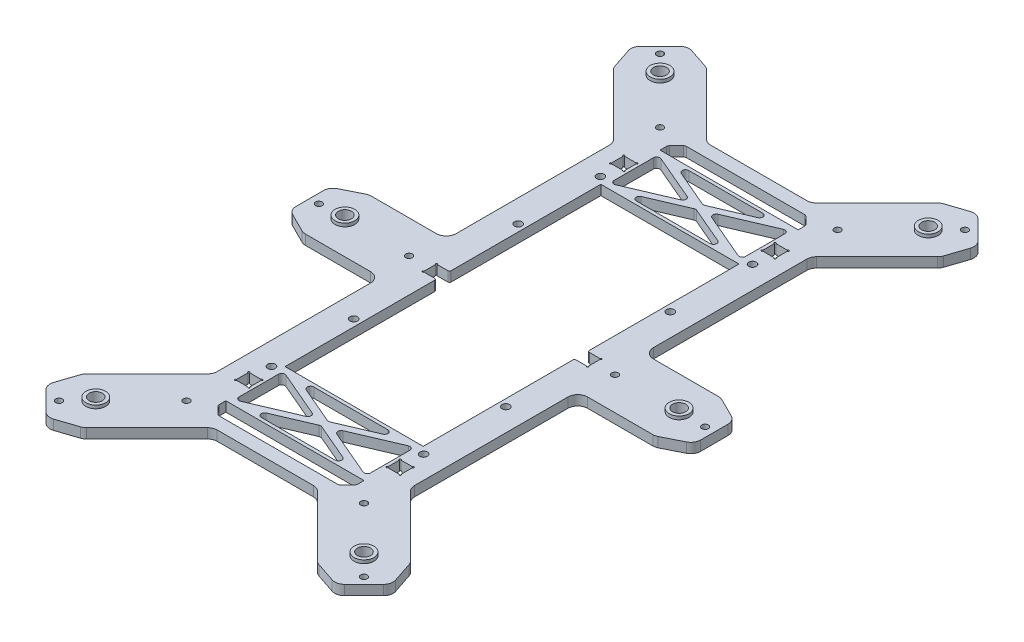
from build123d import *

# Parameters (mm, degrees)
EXTRUDE_1_DEPTH          = 1.5
SKETCH_2_R               = 1
EXTRUDE_2_DEPTH          = 3
MIRROR_2_COPY_1_SKETCH_R = 1
MIRROR_2_COPY_1_DEPTH    = 3
SKETCH_3_W               = 4
SKETCH_3_H               = 4
CUT_EXTRUDE_1_DEPTH      = 3
SKETCH_4_R               = 0.25
CUT_EXTRUDE_2_DEPTH      = 3
FILLET_1_R               = 0.5
FILLET_2_R               = 1
FILLET_3_R               = 3
FILLET_4_R               = 3
SKETCH_5_R               = 2
CUT_EXTRUDE_3_DEPTH      = 3
SKETCH_7_R               = 1.15
CUT_EXTRUDE_5_DEPTH      = 118.428811116
CUT_EXTRUDE_6_REACH      = 119.429
FILLET_5_R               = 3
SKETCH_9_W               = 42
SKETCH_9_H               = 18
EXTRUDE_3_DEPTH          = 3
CUT_EXTRUDE_7_DEPTH      = 3
FILLET_6_R               = 1
SKETCH_11_R              = 0.25
CUT_EXTRUDE_8_DEPTH      = 3
SKETCH_12_R              = 3
SKETCH_12_R_2            = 2
EXTRUDE_4_DEPTH          = 1


with BuildPart() as part:
    # 草图1 → 凸台-拉伸1 (new, symmetric)
    with BuildSketch(Plane(origin=(0, 0, 0), x_dir=(1, 0, 0), z_dir=(0, 1, 0))):
        Polygon((-20, 75), (-30, 65), (-30, -65), (-20, -75), (20, -75), (30, -65), (30, 65), (20, 75), align=None)
        Polygon((-18.343145751, 71), (-1.677763133, 71), (1.677763133, 71), (18.343145751, 71), (21, 68.343145751), (21, -68.343145751), (18.343145751, -71), (1.677763133, -71), (-1.677763133, -71), (-18.343145751, -71), (-21, -68.343145751), (-21, 68.343145751), align=None, mode=Mode.SUBTRACT)
    extrude(amount=EXTRUDE_1_DEPTH, both=True)

    # 草图2 → 凸台-拉伸2 (add, through all)
    # profile 1 of 2: a face of its own
    with BuildSketch(Plane(origin=(0, 1.5, 0), x_dir=(1, 0, 0), z_dir=(0, 1, 0))):
        with BuildLine():
            Line((28.5, 10), (60.5, 10))
            ThreePointArc((60.5, 10), (61.207106781, 9.707106781), (61.5, 9))
            Line((61.5, 9), (61.5, -9))
            ThreePointArc((61.5, -9), (61.207106781, -9.707106781), (60.5, -10))
            Line((60.5, -10), (28.5, -10))
            Line((28.5, -10), (28.5, 10))
        make_face()
        with Locations(Location((58.7, 0, 0), (0, 0, 270))):
            Circle(SKETCH_2_R, mode=Mode.SUBTRACT)
        with Locations(Location((31.3, 0, 0), (0, 0, 90))):
            Circle(SKETCH_2_R, mode=Mode.SUBTRACT)
    # profile 2 of 2: a face of its own
    with BuildSketch(Plane(origin=(0, 1.5, 0), x_dir=(1, 0, 0), z_dir=(0, 1, 0))):
        with BuildLine():
            Line((54.69848481, 85.556349186), (30, 60.857864376))
            Line((30, 60.857864376), (30, 65))
            Line((30, 65), (20, 75))
            Line((20, 75), (15.857864376, 75))
            Line((15.857864376, 75), (40.556349186, 99.69848481))
            ThreePointArc((40.556349186, 99.69848481), (41.263455967, 99.991378029), (41.970562748, 99.69848481))
            Line((41.970562748, 99.69848481), (54.69848481, 86.970562748))
            ThreePointArc((54.69848481, 86.970562748), (54.991378029, 86.263455967), (54.69848481, 85.556349186))
        make_face()
        with Locations(Location((46.354624792, 91.354624792, 0), (0, 0, 270))):
            Circle(SKETCH_2_R, mode=Mode.SUBTRACT)
        with Locations(Location((26.979898987, 71.979898987, 0), (0, 0, 90))):
            Circle(SKETCH_2_R, mode=Mode.SUBTRACT)
    extrude_2 = extrude(amount=-EXTRUDE_2_DEPTH)

    # 镜向1: 凸台-拉伸2 across plane
    add(extrude_2.mirror(Plane.XY))

    # 镜向2: 凸台-拉伸2 across plane
    add(extrude_2.mirror(Plane(origin=(0, 0, 0), x_dir=(0, 0, 1), z_dir=(1, 0, 0))))

    # 镜向2 copy 1 sketch → 镜向2 copy 1 (add, through all)
    # profile 1 of 2: a face of its own
    with BuildSketch(Plane(origin=(0, 1.5, 0), x_dir=(-1, 0, 0), z_dir=(0, 1, 0))):
        with BuildLine():
            Line((28.5, 10), (60.5, 10))
            ThreePointArc((60.5, 10), (61.207106781, 9.707106781), (61.5, 9))
            Line((61.5, 9), (61.5, -9))
            ThreePointArc((61.5, -9), (61.207106781, -9.707106781), (60.5, -10))
            Line((60.5, -10), (28.5, -10))
            Line((28.5, -10), (28.5, 10))
        make_face()
        with Locations(Location((58.7, 0, 0), (0, 0, 270))):
            Circle(MIRROR_2_COPY_1_SKETCH_R, mode=Mode.SUBTRACT)
        with Locations(Location((31.3, 0, 0), (0, 0, 90))):
            Circle(MIRROR_2_COPY_1_SKETCH_R, mode=Mode.SUBTRACT)
    # profile 2 of 2: a face of its own
    with BuildSketch(Plane(origin=(0, 1.5, 0), x_dir=(-1, 0, 0), z_dir=(0, 1, 0))):
        with BuildLine():
            Line((54.69848481, 85.556349186), (30, 60.857864376))
            Line((30, 60.857864376), (30, 65))
            Line((30, 65), (20, 75))
            Line((20, 75), (15.857864376, 75))
            Line((15.857864376, 75), (40.556349186, 99.69848481))
            ThreePointArc((40.556349186, 99.69848481), (41.263455967, 99.991378029), (41.970562748, 99.69848481))
            Line((41.970562748, 99.69848481), (54.69848481, 86.970562748))
            ThreePointArc((54.69848481, 86.970562748), (54.991378029, 86.263455967), (54.69848481, 85.556349186))
        make_face()
        with Locations(Location((46.354624792, 91.354624792, 0), (0, 0, 270))):
            Circle(MIRROR_2_COPY_1_SKETCH_R, mode=Mode.SUBTRACT)
        with Locations(Location((26.979898987, 71.979898987, 0), (0, 0, 90))):
            Circle(MIRROR_2_COPY_1_SKETCH_R, mode=Mode.SUBTRACT)
    extrude(amount=-MIRROR_2_COPY_1_DEPTH)

    # 草图3 → 切除-拉伸1 (cut)
    with BuildSketch(Plane(origin=(0, 1.5, 0), x_dir=(1, 0, 0), z_dir=(0, 1, 0))):
        with Locations((23, 0)):
            Rectangle(SKETCH_3_W, SKETCH_3_H)
        with Locations((23, -57)):
            Rectangle(SKETCH_3_W, SKETCH_3_H)
        with Locations((23, 57)):
            Rectangle(SKETCH_3_W, SKETCH_3_H)
        with Locations((-23, 57)):
            Rectangle(SKETCH_3_W, SKETCH_3_H)
        with Locations((-23, 0)):
            Rectangle(SKETCH_3_W, SKETCH_3_H)
        with Locations((-23, -57)):
            Rectangle(SKETCH_3_W, SKETCH_3_H)
    extrude(amount=-CUT_EXTRUDE_1_DEPTH, mode=Mode.SUBTRACT)

    # 草图4 → 切除-拉伸2 (cut)
    with BuildSketch(Plane(origin=(0, 1.5, 0), x_dir=(1, 0, 0), z_dir=(0, 1, 0))):
        with Locations((25, 59)):
            Circle(SKETCH_4_R)
        with Locations((25, 55)):
            Circle(SKETCH_4_R)
        with Locations((25, 2)):
            Circle(SKETCH_4_R)
        with Locations((25, -2)):
            Circle(SKETCH_4_R)
        with Locations((25, -55)):
            Circle(SKETCH_4_R)
        with Locations((25, -59)):
            Circle(SKETCH_4_R)
        with Locations((-25, -59)):
            Circle(SKETCH_4_R)
        with Locations((-25, -55)):
            Circle(SKETCH_4_R)
        with Locations((-25, -2)):
            Circle(SKETCH_4_R)
        with Locations((-25, 2)):
            Circle(SKETCH_4_R)
        with Locations((-25, 55)):
            Circle(SKETCH_4_R)
        with Locations((-25, 59)):
            Circle(SKETCH_4_R)
    extrude(amount=-CUT_EXTRUDE_2_DEPTH, mode=Mode.SUBTRACT)

    # 圆角1
    fillet_1_edges = [part.edges().sort_by_distance(p)[0] for p in [
        (-21, 0, -2),
        (-21, 0, 2),
        (21, 0, 2),
        (21, 0, -2),
    ]]
    fillet(fillet_1_edges, radius=FILLET_1_R)

    # 圆角2
    fillet_2_edges = [part.edges().sort_by_distance(p)[0] for p in [
        (-18.343145751, 0, -71),
        (-21, 0, -68.343145751),
        (-21, 0, 68.343145751),
        (-18.343145751, 0, 71),
        (18.343145751, 0, 71),
        (21, 0, 68.343145751),
        (21, 0, -68.343145751),
        (18.343145751, 0, -71),
    ]]
    fillet(fillet_2_edges, radius=FILLET_2_R)

    # 圆角3
    fillet_3_edges = [part.edges().sort_by_distance(p)[0] for p in [
        (15.857864376, 0, 75),
        (30, 0, 60.857864376),
        (-30, 0, 10),
        (-15.857864376, 0, 75),
        (-30, 0, 60.857864376),
        (30, 0, 10),
    ]]
    fillet(fillet_3_edges, radius=FILLET_3_R)

    # 圆角4
    fillet_4_edges = [part.edges().sort_by_distance(p)[0] for p in [
        (15.857864376, 0, -75),
        (30, 0, -60.857864376),
        (-30, 0, -10),
        (-15.857864376, 0, -75),
        (-30, 0, -60.857864376),
        (30, 0, -10),
    ]]
    fillet(fillet_4_edges, radius=FILLET_4_R)

    # 草图5 → 切除-拉伸3 (cut)
    with BuildSketch(Plane.XZ.offset(1.5)):
        with Locations(Location((-50.8, 0, 0), (0, 0, 270))):
            Circle(SKETCH_5_R)
        with Locations(Location((-40.76848122, -85.76848122, 0), (0, 0, 270))):
            Circle(SKETCH_5_R)
        with Locations(Location((-40.76848122, 85.76848122, 0), (0, 0, 90))):
            Circle(SKETCH_5_R)
        with Locations(Location((40.76848122, -85.76848122, 0), (0, 0, 90))):
            Circle(SKETCH_5_R)
        with Locations(Location((50.8, 0, 0), (0, 0, 90))):
            Circle(SKETCH_5_R)
        with Locations(Location((40.76848122, 85.76848122, 0), (0, 0, 270))):
            Circle(SKETCH_5_R)
    extrude(amount=-CUT_EXTRUDE_3_DEPTH, mode=Mode.SUBTRACT)

    # 草图7 → 切除-拉伸5 (cut, through all)
    with BuildSketch(Plane.XZ.offset(1.5)):
        with Locations(Location((-23.125, -25, 0), (0, 0, 270))):
            Circle(SKETCH_7_R)
        with Locations(Location((-23.125, -50, 0), (0, 0, 270))):
            Circle(SKETCH_7_R)
        with Locations(Location((-23.125, 50, 0), (0, 0, 90))):
            Circle(SKETCH_7_R)
        with Locations(Location((-23.125, 25, 0), (0, 0, 90))):
            Circle(SKETCH_7_R)
        with Locations(Location((23.125, -25, 0), (0, 0, 90))):
            Circle(SKETCH_7_R)
        with Locations(Location((23.125, -50, 0), (0, 0, 90))):
            Circle(SKETCH_7_R)
        with Locations(Location((23.125, 25, 0), (0, 0, 270))):
            Circle(SKETCH_7_R)
        with Locations(Location((23.125, 50, 0), (0, 0, 270))):
            Circle(SKETCH_7_R)
    extrude(amount=-CUT_EXTRUDE_5_DEPTH, mode=Mode.SUBTRACT)

    # 草图8 → 切除-拉伸6 (cut, up to next)
    with BuildSketch(Plane(origin=(0, 1.5, 0), x_dir=(1, 0, 0), z_dir=(0, 1, 0)), mode=Mode.PRIVATE) as cut_extrude_6_sk1:
        with BuildLine():
            Line((61.5, 6), (53.5, 10))
            Line((53.5, 10), (60.5, 10))
            ThreePointArc((60.5, 10), (61.207106781, 9.707106781), (61.5, 9))
            Line((61.5, 9), (61.5, 6))
        make_face()
    cut_extrude_6_tool1 = extrude(cut_extrude_6_sk1.sketch, amount=-CUT_EXTRUDE_6_REACH, mode=Mode.PRIVATE) & part.part
    # 草图8 → 切除-拉伸6 (cut, up to next)
    with BuildSketch(Plane(origin=(0, 1.5, 0), x_dir=(1, 0, 0), z_dir=(0, 1, 0)), mode=Mode.PRIVATE) as cut_extrude_6_sk2:
        with BuildLine():
            Line((61.5, -6), (53.5, -10))
            Line((53.5, -10), (60.5, -10))
            ThreePointArc((60.5, -10), (61.207106781, -9.707106781), (61.5, -9))
            Line((61.5, -9), (61.5, -6))
        make_face()
    cut_extrude_6_tool2 = extrude(cut_extrude_6_sk2.sketch, amount=-CUT_EXTRUDE_6_REACH, mode=Mode.PRIVATE) & part.part
    # 草图8 → 切除-拉伸6 (cut, up to next)
    with BuildSketch(Plane(origin=(0, 1.5, 0), x_dir=(1, 0, 0), z_dir=(0, 1, 0)), mode=Mode.PRIVATE) as cut_extrude_6_sk3:
        with BuildLine():
            Line((52.577164466, -89.091883092), (49.748737342, -80.606601718))
            Line((49.748737342, -80.606601718), (54.69848481, -85.556349186))
            ThreePointArc((54.69848481, -85.556349186), (54.991378029, -86.263455967), (54.69848481, -86.970562748))
            Line((54.69848481, -86.970562748), (52.577164466, -89.091883092))
        make_face()
    cut_extrude_6_tool3 = extrude(cut_extrude_6_sk3.sketch, amount=-CUT_EXTRUDE_6_REACH, mode=Mode.PRIVATE) & part.part
    # 草图8 → 切除-拉伸6 (cut, up to next)
    with BuildSketch(Plane(origin=(0, 1.5, 0), x_dir=(1, 0, 0), z_dir=(0, 1, 0)), mode=Mode.PRIVATE) as cut_extrude_6_sk4:
        with BuildLine():
            Line((44.091883092, -97.577164466), (35.606601718, -94.748737342))
            Line((35.606601718, -94.748737342), (40.556349186, -99.69848481))
            ThreePointArc((40.556349186, -99.69848481), (41.263455967, -99.991378029), (41.970562748, -99.69848481))
            Line((41.970562748, -99.69848481), (44.091883092, -97.577164466))
        make_face()
    cut_extrude_6_tool4 = extrude(cut_extrude_6_sk4.sketch, amount=-CUT_EXTRUDE_6_REACH, mode=Mode.PRIVATE) & part.part
    # 草图8 → 切除-拉伸6 (cut, up to next)
    with BuildSketch(Plane(origin=(0, 1.5, 0), x_dir=(1, 0, 0), z_dir=(0, 1, 0)), mode=Mode.PRIVATE) as cut_extrude_6_sk5:
        with BuildLine():
            Line((52.577164466, 89.091883092), (49.748737342, 80.606601718))
            Line((49.748737342, 80.606601718), (54.69848481, 85.556349186))
            ThreePointArc((54.69848481, 85.556349186), (54.991378029, 86.263455967), (54.69848481, 86.970562748))
            Line((54.69848481, 86.970562748), (52.577164466, 89.091883092))
        make_face()
    cut_extrude_6_tool5 = extrude(cut_extrude_6_sk5.sketch, amount=-CUT_EXTRUDE_6_REACH, mode=Mode.PRIVATE) & part.part
    # 草图8 → 切除-拉伸6 (cut, up to next)
    with BuildSketch(Plane(origin=(0, 1.5, 0), x_dir=(1, 0, 0), z_dir=(0, 1, 0)), mode=Mode.PRIVATE) as cut_extrude_6_sk6:
        with BuildLine():
            Line((44.091883092, 97.577164466), (41.970562748, 99.69848481))
            ThreePointArc((41.970562748, 99.69848481), (41.263455967, 99.991378029), (40.556349186, 99.69848481))
            Line((40.556349186, 99.69848481), (35.606601718, 94.748737342))
            Line((35.606601718, 94.748737342), (44.091883092, 97.577164466))
        make_face()
    cut_extrude_6_tool6 = extrude(cut_extrude_6_sk6.sketch, amount=-CUT_EXTRUDE_6_REACH, mode=Mode.PRIVATE) & part.part
    # 草图8 → 切除-拉伸6 (cut, up to next)
    with BuildSketch(Plane(origin=(0, 1.5, 0), x_dir=(1, 0, 0), z_dir=(0, 1, 0)), mode=Mode.PRIVATE) as cut_extrude_6_sk7:
        with BuildLine():
            Line((-44.091883092, -97.577164466), (-41.970562748, -99.69848481))
            ThreePointArc((-41.970562748, -99.69848481), (-41.263455967, -99.991378029), (-40.556349186, -99.69848481))
            Line((-40.556349186, -99.69848481), (-35.606601718, -94.748737342))
            Line((-35.606601718, -94.748737342), (-44.091883092, -97.577164466))
        make_face()
    cut_extrude_6_tool7 = extrude(cut_extrude_6_sk7.sketch, amount=-CUT_EXTRUDE_6_REACH, mode=Mode.PRIVATE) & part.part
    # 草图8 → 切除-拉伸6 (cut, up to next)
    with BuildSketch(Plane(origin=(0, 1.5, 0), x_dir=(1, 0, 0), z_dir=(0, 1, 0)), mode=Mode.PRIVATE) as cut_extrude_6_sk8:
        with BuildLine():
            Line((-52.577164466, -89.091883092), (-49.748737342, -80.606601718))
            Line((-49.748737342, -80.606601718), (-54.69848481, -85.556349186))
            ThreePointArc((-54.69848481, -85.556349186), (-54.991378029, -86.263455967), (-54.69848481, -86.970562748))
            Line((-54.69848481, -86.970562748), (-52.577164466, -89.091883092))
        make_face()
    cut_extrude_6_tool8 = extrude(cut_extrude_6_sk8.sketch, amount=-CUT_EXTRUDE_6_REACH, mode=Mode.PRIVATE) & part.part
    # 草图8 → 切除-拉伸6 (cut, up to next)
    with BuildSketch(Plane(origin=(0, 1.5, 0), x_dir=(1, 0, 0), z_dir=(0, 1, 0)), mode=Mode.PRIVATE) as cut_extrude_6_sk9:
        with BuildLine():
            Line((-53.5, -10), (-60.5, -10))
            ThreePointArc((-60.5, -10), (-61.207106781, -9.707106781), (-61.5, -9))
            Line((-61.5, -9), (-61.5, -6))
            Line((-61.5, -6), (-53.5, -10))
        make_face()
    cut_extrude_6_tool9 = extrude(cut_extrude_6_sk9.sketch, amount=-CUT_EXTRUDE_6_REACH, mode=Mode.PRIVATE) & part.part
    # 草图8 → 切除-拉伸6 (cut, up to next)
    with BuildSketch(Plane(origin=(0, 1.5, 0), x_dir=(1, 0, 0), z_dir=(0, 1, 0)), mode=Mode.PRIVATE) as cut_extrude_6_sk10:
        with BuildLine():
            Line((-61.5, 6), (-61.5, 9))
            ThreePointArc((-61.5, 9), (-61.207106781, 9.707106781), (-60.5, 10))
            Line((-60.5, 10), (-53.5, 10))
            Line((-53.5, 10), (-61.5, 6))
        make_face()
    cut_extrude_6_tool10 = extrude(cut_extrude_6_sk10.sketch, amount=-CUT_EXTRUDE_6_REACH, mode=Mode.PRIVATE) & part.part
    # 草图8 → 切除-拉伸6 (cut, up to next)
    with BuildSketch(Plane(origin=(0, 1.5, 0), x_dir=(1, 0, 0), z_dir=(0, 1, 0)), mode=Mode.PRIVATE) as cut_extrude_6_sk11:
        with BuildLine():
            Line((-54.69848481, 86.970562748), (-52.577164466, 89.091883092))
            Line((-52.577164466, 89.091883092), (-49.748737342, 80.606601718))
            Line((-49.748737342, 80.606601718), (-54.69848481, 85.556349186))
            ThreePointArc((-54.69848481, 85.556349186), (-54.991378029, 86.263455967), (-54.69848481, 86.970562748))
        make_face()
    cut_extrude_6_tool11 = extrude(cut_extrude_6_sk11.sketch, amount=-CUT_EXTRUDE_6_REACH, mode=Mode.PRIVATE) & part.part
    # 草图8 → 切除-拉伸6 (cut, up to next)
    with BuildSketch(Plane(origin=(0, 1.5, 0), x_dir=(1, 0, 0), z_dir=(0, 1, 0)), mode=Mode.PRIVATE) as cut_extrude_6_sk12:
        with BuildLine():
            Line((-40.556349186, 99.69848481), (-35.606601718, 94.748737342))
            Line((-35.606601718, 94.748737342), (-44.091883092, 97.577164466))
            Line((-44.091883092, 97.577164466), (-41.970562748, 99.69848481))
            ThreePointArc((-41.970562748, 99.69848481), (-41.263455967, 99.991378029), (-40.556349186, 99.69848481))
        make_face()
    cut_extrude_6_tool12 = extrude(cut_extrude_6_sk12.sketch, amount=-CUT_EXTRUDE_6_REACH, mode=Mode.PRIVATE) & part.part
    add(cut_extrude_6_tool1.solids().sort_by_distance((58.800117, 1.5, -8.651577))[0], mode=Mode.SUBTRACT)
    add(cut_extrude_6_tool2.solids().sort_by_distance((58.800117, 1.5, 8.651577))[0], mode=Mode.SUBTRACT)
    add(cut_extrude_6_tool3.solids().sort_by_distance((52.543007, 1.5, 85.307829))[0], mode=Mode.SUBTRACT)
    add(cut_extrude_6_tool4.solids().sort_by_distance((40.307829, 1.5, 97.543007))[0], mode=Mode.SUBTRACT)
    add(cut_extrude_6_tool5.solids().sort_by_distance((52.543007, 1.5, -85.307829))[0], mode=Mode.SUBTRACT)
    add(cut_extrude_6_tool6.solids().sort_by_distance((40.307829, 1.5, -97.543007))[0], mode=Mode.SUBTRACT)
    add(cut_extrude_6_tool7.solids().sort_by_distance((-40.307829, 1.5, 97.543007))[0], mode=Mode.SUBTRACT)
    add(cut_extrude_6_tool8.solids().sort_by_distance((-52.543007, 1.5, 85.307829))[0], mode=Mode.SUBTRACT)
    add(cut_extrude_6_tool9.solids().sort_by_distance((-58.800117, 1.5, 8.651577))[0], mode=Mode.SUBTRACT)
    add(cut_extrude_6_tool10.solids().sort_by_distance((-58.800117, 1.5, -8.651577))[0], mode=Mode.SUBTRACT)
    add(cut_extrude_6_tool11.solids().sort_by_distance((-52.543007, 1.5, -85.307829))[0], mode=Mode.SUBTRACT)
    add(cut_extrude_6_tool12.solids().sort_by_distance((-40.307829, 1.5, -97.543007))[0], mode=Mode.SUBTRACT)

    # 圆角5
    fillet_5_edges = [part.edges().sort_by_distance(p)[0] for p in [
        (-61.5, 0, 6),
        (-53.5, 0, 10),
        (-49.748737342, 0, 80.606601718),
        (-52.577164466, 0, 89.091883092),
        (-44.091883092, 0, 97.577164466),
        (-35.606601718, 0, 94.748737342),
        (44.091883092, 0, -97.577164466),
        (35.606601718, 0, -94.748737342),
        (61.5, 0, 6),
        (53.5, 0, 10),
        (52.577164466, 0, 89.091883092),
        (49.748737342, 0, 80.606601718),
        (35.606601718, 0, 94.748737342),
        (44.091883092, 0, 97.577164466),
        (49.748737342, 0, -80.606601718),
        (52.577164466, 0, -89.091883092),
        (-53.5, 0, -10),
        (-61.5, 0, -6),
        (-52.577164466, 0, -89.091883092),
        (-49.748737342, 0, -80.606601718),
        (-35.606601718, 0, -94.748737342),
        (-44.091883092, 0, -97.577164466),
        (61.5, 0, -6),
        (53.5, 0, -10),
    ]]
    fillet(fillet_5_edges, radius=FILLET_5_R)

    # 草图9 → 凸台-拉伸3 (add)
    with BuildSketch(Plane(origin=(0, 1.5, 0), x_dir=(1, 0, 0), z_dir=(0, 1, 0))):
        with Locations((0, 57)):
            Rectangle(SKETCH_9_W, SKETCH_9_H)
        with Locations((0, -57)):
            Rectangle(SKETCH_9_W, SKETCH_9_H)
    extrude(amount=-EXTRUDE_3_DEPTH)

    # 草图10 → 切除-拉伸7 (cut)
    with BuildSketch(Plane(origin=(0, 1.5, 0), x_dir=(1, 0, 0), z_dir=(0, 1, 0))):
        Polygon((16.128075631, 65), (0, 58.087967587), (-16.128075631, 65), align=None)
        Polygon((20, 64.483460985), (2.538591035, 57), (20, 49.516539015), align=None)
        Polygon((0, 55.912032413), (-16.128075631, 49), (16.128075631, 49), align=None)
        Polygon((-2.538591035, 57), (-20, 49.516539015), (-20, 64.483460985), align=None)
        Polygon((0, -55.912032413), (-16.128075631, -49), (16.128075631, -49), align=None)
        Polygon((-2.538591035, -57), (-20, -49.516539015), (-20, -64.483460985), align=None)
        Polygon((16.128075631, -65), (0, -58.087967587), (-16.128075631, -65), align=None)
        Polygon((20, -64.483460985), (20, -49.516539015), (2.538591035, -57), align=None)
    extrude(amount=-CUT_EXTRUDE_7_DEPTH, mode=Mode.SUBTRACT)

    # 圆角6
    fillet_6_edges = [part.edges().sort_by_distance(p)[0] for p in [
        (16.128075631, 0, 49),
        (0, 0, 55.912032413),
        (-16.128075631, 0, 49),
        (-20, 0, -64.483460985),
        (-2.538591035, 0, -57),
        (-20, 0, -49.516539015),
        (20, 0, -64.483460985),
        (20, 0, -49.516539015),
        (2.538591035, 0, -57),
        (0, 0, -58.087967587),
        (-16.128075631, 0, -65),
        (16.128075631, 0, -65),
        (20, 0, 64.483460985),
        (2.538591035, 0, 57),
        (20, 0, 49.516539015),
        (-2.538591035, 0, 57),
        (-20, 0, 64.483460985),
        (-20, 0, 49.516539015),
        (16.128075631, 0, 65),
        (-16.128075631, 0, 65),
        (0, 0, 58.087967587),
        (16.128075631, 0, -49),
        (-16.128075631, 0, -49),
        (0, 0, -55.912032413),
    ]]
    fillet(fillet_6_edges, radius=FILLET_6_R)

    # 草图11 → 切除-拉伸8 (cut)
    with BuildSketch(Plane(origin=(0, 1.5, 0), x_dir=(1, 0, 0), z_dir=(0, 1, 0))):
        with Locations((21, -55)):
            Circle(SKETCH_11_R)
        with Locations((21, -59)):
            Circle(SKETCH_11_R)
        with Locations((-21, -59)):
            Circle(SKETCH_11_R)
        with Locations((-21, -55)):
            Circle(SKETCH_11_R)
        with Locations((-21, 55)):
            Circle(SKETCH_11_R)
        with Locations((-21, 59)):
            Circle(SKETCH_11_R)
        with Locations((21, 59)):
            Circle(SKETCH_11_R)
        with Locations((21, 55)):
            Circle(SKETCH_11_R)
    extrude(amount=-CUT_EXTRUDE_8_DEPTH, mode=Mode.SUBTRACT)

    # 草图12 → 凸台-拉伸4 (add)
    # profile 1 of 6: a face of its own
    with BuildSketch(Plane(origin=(0, 1.5, 0), x_dir=(1, 0, 0), z_dir=(0, 1, 0))):
        with Locations(Location((50.8, 0, 0), (0, 0, 270))):
            Circle(SKETCH_12_R)
        with Locations(Location((50.8, 0, 0), (0, 0, 270))):
            Circle(SKETCH_12_R_2, mode=Mode.SUBTRACT)
    # profile 2 of 6: a face of its own
    with BuildSketch(Plane(origin=(0, 1.5, 0), x_dir=(1, 0, 0), z_dir=(0, 1, 0))):
        with Locations(Location((40.76848122, 85.76848122, 0), (0, 0, 270))):
            Circle(SKETCH_12_R)
        with Locations(Location((40.76848122, 85.76848122, 0), (0, 0, 270))):
            Circle(SKETCH_12_R_2, mode=Mode.SUBTRACT)
    # profile 3 of 6: a face of its own
    with BuildSketch(Plane(origin=(0, 1.5, 0), x_dir=(1, 0, 0), z_dir=(0, 1, 0))):
        with Locations(Location((40.76848122, -85.76848122, 0), (0, 0, 270))):
            Circle(SKETCH_12_R)
        with Locations(Location((40.76848122, -85.76848122, 0), (0, 0, 90))):
            Circle(SKETCH_12_R_2, mode=Mode.SUBTRACT)
    # profile 4 of 6: a face of its own
    with BuildSketch(Plane(origin=(0, 1.5, 0), x_dir=(1, 0, 0), z_dir=(0, 1, 0))):
        with Locations(Location((-40.76848122, -85.76848122, 0), (0, 0, 90))):
            Circle(SKETCH_12_R)
        with Locations(Location((-40.76848122, -85.76848122, 0), (0, 0, 90))):
            Circle(SKETCH_12_R_2, mode=Mode.SUBTRACT)
    # profile 5 of 6: a face of its own
    with BuildSketch(Plane(origin=(0, 1.5, 0), x_dir=(1, 0, 0), z_dir=(0, 1, 0))):
        with Locations(Location((-40.76848122, 85.76848122, 0), (0, 0, 90))):
            Circle(SKETCH_12_R)
        with Locations(Location((-40.76848122, 85.76848122, 0), (0, 0, 90))):
            Circle(SKETCH_12_R_2, mode=Mode.SUBTRACT)
    # profile 6 of 6: a face of its own
    with BuildSketch(Plane(origin=(0, 1.5, 0), x_dir=(1, 0, 0), z_dir=(0, 1, 0))):
        with Locations(Location((-50.8, 0, 0), (0, 0, 90))):
            Circle(SKETCH_12_R)
        with Locations(Location((-50.8, 0, 0), (0, 0, 90))):
            Circle(SKETCH_12_R_2, mode=Mode.SUBTRACT)
    extrude(amount=EXTRUDE_4_DEPTH)


solid = part.part
